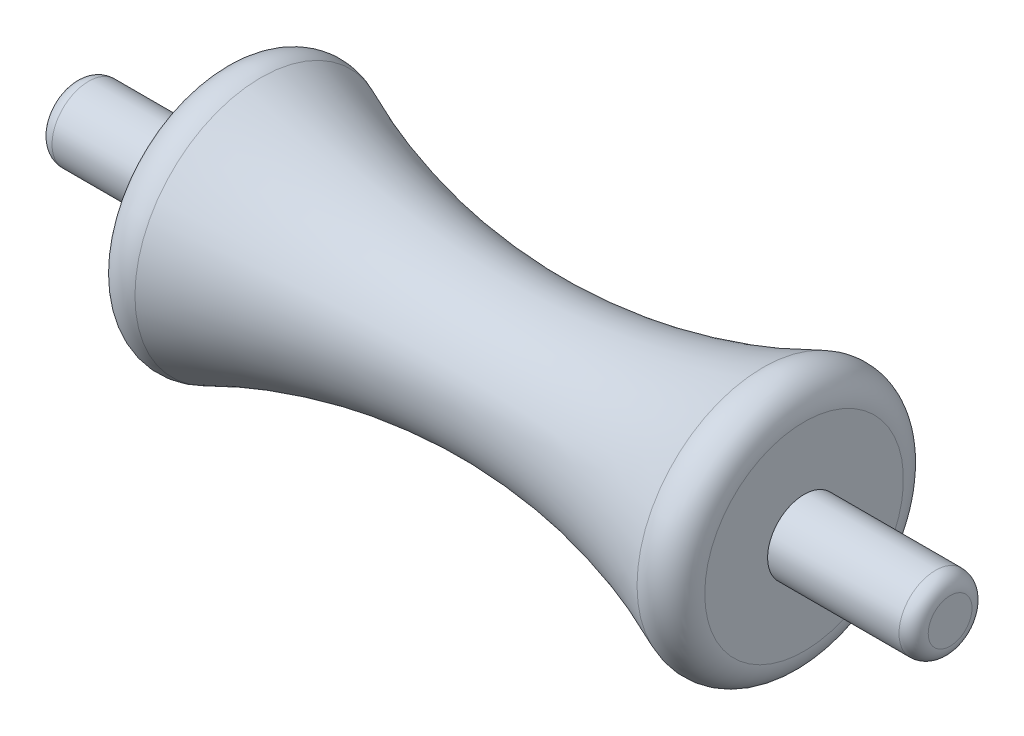
from build123d import *


with BuildPart() as part:
    # Sketch3 → Revolve1 (revolve)
    with BuildSketch(Plane.XY, mode=Mode.PRIVATE) as revolve1_sk:
        with BuildLine():
            Line((-60, 0), (60, 0))
            Line((60, 0), (60, -3))
            ThreePointArc((60, -3), (59.414213562, -4.414213562), (58, -5))
            Line((58, -5), (40, -5))
            Line((40, -5), (40, -13.60589702))
            ThreePointArc((40, -13.60589702), (38.182669225, -16.957904635), (34.382022472, -17.264058951))
            ThreePointArc((34.382022472, -17.264058951), (0, -10), (-34.382022472, -17.264058951))
            ThreePointArc((-34.382022472, -17.264058951), (-38.182669225, -16.957904635), (-40, -13.60589702))
            Line((-40, -13.60589702), (-40, -5))
            Line((-40, -5), (-58, -5))
            ThreePointArc((-58, -5), (-59.414213562, -4.414213562), (-60, -3))
            Line((-60, -3), (-60, 0))
        make_face()
    revolve(revolve1_sk.sketch.rotate(Axis((-60, 0, 0), (1, 0, 0)), 270), axis=Axis((-60, 0, 0), (1, 0, 0)))


solid = part.part
